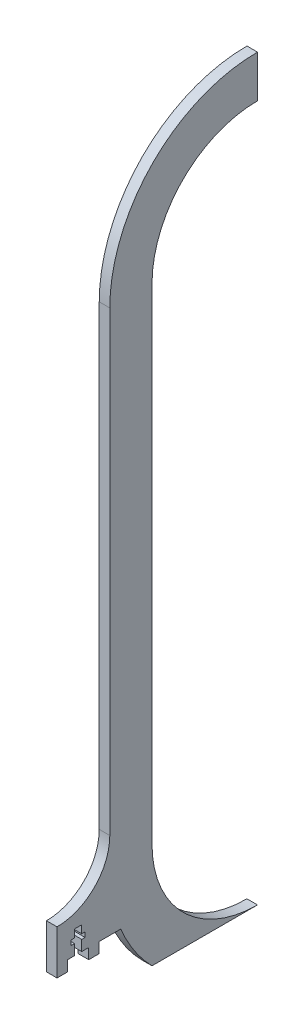
from build123d import *

# Parameters (mm, degrees)
BOSS_EXTRUDE2_DEPTH = 6.35


with BuildPart() as part:
    # Elevator Ball Support Rail → Boss-Extrude2 (new body)
    with BuildSketch(Plane(origin=(0, 0, 0), x_dir=(0, 0, -1), z_dir=(1, 0, 0))):
        with BuildLine():
            Line((63.5, 209.55), (63.5, 234.95))
            ThreePointArc((63.5, 234.95), (0.638207153, 208.911792847), (-25.4, 146.05))
            Line((-25.4, 146.05), (-25.4, -128.905))
            ThreePointArc((-25.4, -128.905), (-34.699359697, -151.355640303), (-57.15, -160.655))
            Line((-57.15, -160.655), (-57.15, -187.325))
            Line((-57.15, -187.325), (-50.8, -187.325))
            Line((-50.8, -187.325), (-50.8, -180.975))
            Line((-50.8, -180.975), (-46.609, -180.975))
            Line((-46.609, -180.975), (-46.609, -174.625))
            Line((-46.609, -174.625), (-48.649999982, -174.625))
            Line((-48.649999982, -174.625), (-48.649999982, -171.724999958))
            Line((-48.649999982, -171.724999958), (-46.609, -171.724999958))
            Line((-46.609, -171.724999958), (-46.609, -167.005))
            Line((-46.609, -167.005), (-42.291, -167.005))
            Line((-42.291, -167.005), (-42.291, -171.724999958))
            Line((-42.291, -171.724999958), (-40.250000018, -171.724999958))
            Line((-40.250000018, -171.724999958), (-40.250000018, -174.625))
            Line((-40.250000018, -174.625), (-42.291, -174.625))
            Line((-42.291, -174.625), (-42.291, -180.975))
            Line((-42.291, -180.975), (-38.1, -180.975))
            Line((-38.1, -180.975), (-38.1, -187.325))
            Line((-38.1, -187.325), (-31.75, -187.325))
            Line((-31.75, -187.325), (-31.75, -180.975))
            Line((-31.75, -180.975), (-18.788657666, -180.975))
            ThreePointArc((-18.788657666, -180.975), (-10.781328961, -196.174481473), (0, -209.55))
            Line((0, -209.55), (63.5, -209.55))
            ThreePointArc((63.5, -209.55), (18.598719395, -190.951280605), (0, -146.05))
            Line((0, -146.05), (0, 146.05))
            ThreePointArc((0, 146.05), (18.598719395, 190.951280605), (63.5, 209.55))
        make_face()
    extrude(amount=BOSS_EXTRUDE2_DEPTH)


solid = part.part
